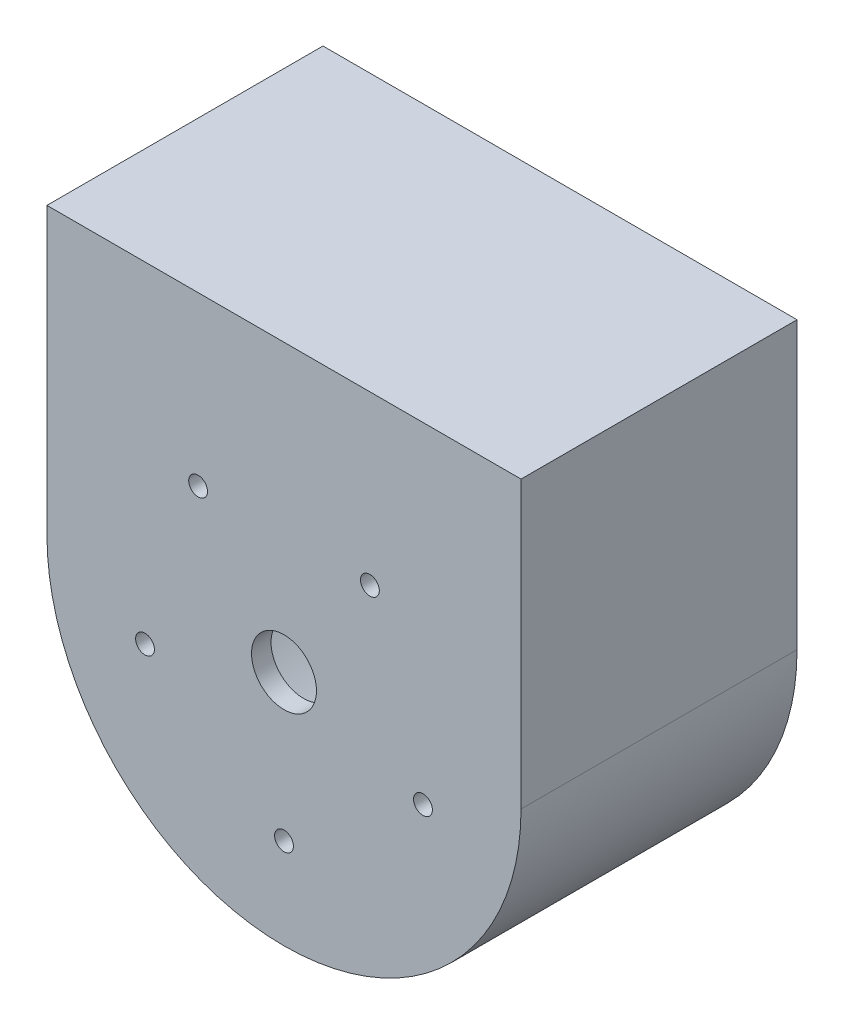
from build123d import *

# Parameters (mm, degrees)
SKETCH1_R           = 36.5
BOSS_EXTRUDE1_DEPTH = 42.5
SKETCH2_W           = 73
SKETCH2_H           = 44
BOSS_EXTRUDE2_DEPTH = 42.5
SKETCH3_R           = 31.5
CUT_EXTRUDE1_DEPTH  = 39.5
SKETCH4_W           = 63
SKETCH4_H           = 41.5
CUT_EXTRUDE2_DEPTH  = 39.5
SKETCH5_R           = 5
SKETCH5_R_2         = 1.45
CUT_EXTRUDE3_DEPTH  = 3


with BuildPart() as part:
    # Sketch1 → Boss-Extrude1 (new body)
    with BuildSketch(Plane.XY.offset(350)):
        with Locations((300, 300)):
            Circle(SKETCH1_R)
    extrude(amount=BOSS_EXTRUDE1_DEPTH)

    # Sketch2 → Boss-Extrude2 (add)
    with BuildSketch(Plane.XY.offset(350)):
        with Locations((300, 322)):
            Rectangle(SKETCH2_W, SKETCH2_H)
    extrude(amount=BOSS_EXTRUDE2_DEPTH)

    # Sketch3 → Cut-Extrude1 (cut)
    with BuildSketch(Plane.XY.offset(350)):
        with Locations((300, 300)):
            Circle(SKETCH3_R)
    extrude(amount=CUT_EXTRUDE1_DEPTH, mode=Mode.SUBTRACT)

    # Sketch4 → Cut-Extrude2 (cut)
    with BuildSketch(Plane.XY.offset(350)):
        with Locations((300, 320.75)):
            Rectangle(SKETCH4_W, SKETCH4_H)
    extrude(amount=CUT_EXTRUDE2_DEPTH, mode=Mode.SUBTRACT)

    # Sketch5 → Cut-Extrude3 (cut)
    with BuildSketch(Plane.XY.offset(389.5)):
        with Locations((300, 300)):
            Circle(SKETCH5_R)
        with Locations((286.774831823, 318.202882373)):
            Circle(SKETCH5_R_2)
        with Locations((278.601228383, 293.047117627)):
            Circle(SKETCH5_R_2)
        with Locations((300, 277.5)):
            Circle(SKETCH5_R_2)
        with Locations((321.398771617, 293.047117627)):
            Circle(SKETCH5_R_2)
        with Locations((313.225168177, 318.202882373)):
            Circle(SKETCH5_R_2)
    extrude(amount=CUT_EXTRUDE3_DEPTH, mode=Mode.SUBTRACT)


solid = part.part
